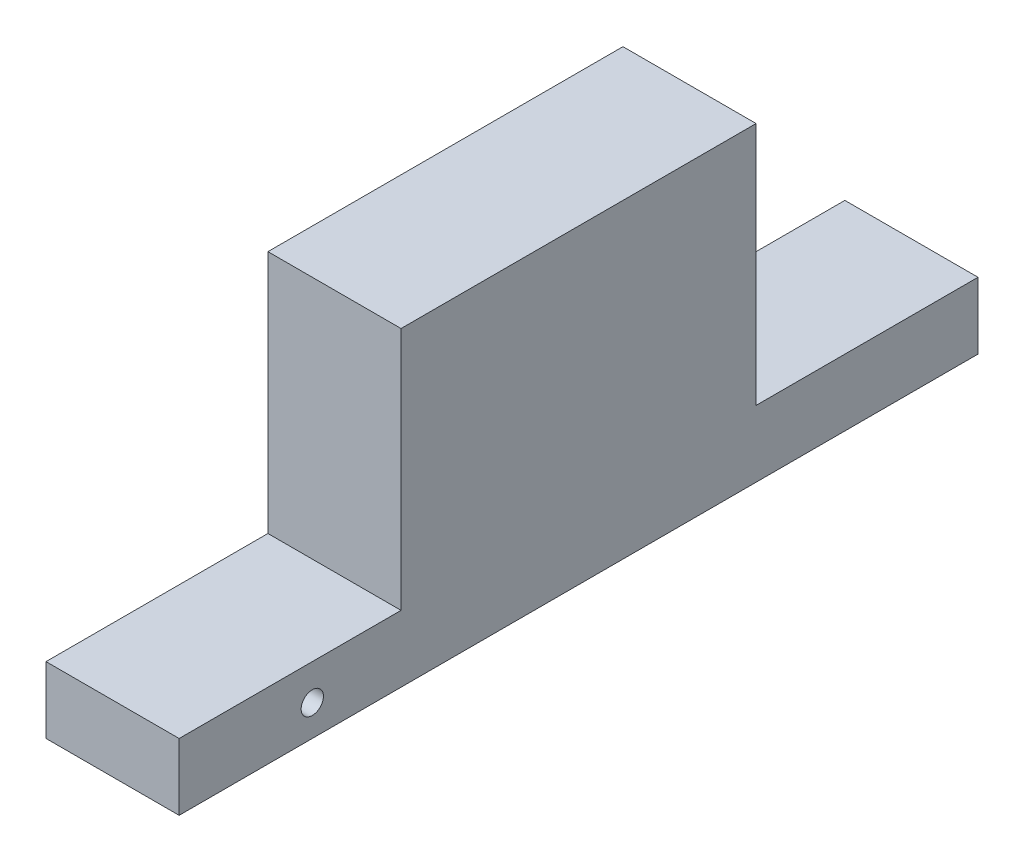
from build123d import *

# Parameters (mm, degrees)
MAINBODY_EXTRUDE_START        = -15
MAINBODY_EXTRUDE_DEPTH        = 30
PIVOTSHAFTHOLE_CUT_DEPTH      = 98.724101428
PIVOTSHAFTHOLE_CUT_DEPTH_BACK = 98.724101428
PIVOTSHAFTHOLE_SKETCH_R       = 2.51


with BuildPart() as part:
    # projectionYz_sketch → mainBody_extrude (new body)
    with BuildSketch(Plane(origin=(0, 0, 0), x_dir=(0, 0, -1), z_dir=(1, 0, 0)).offset(MAINBODY_EXTRUDE_START)):
        Polygon((90, -35), (90, -20), (40, -20), (40, 35), (-40, 35), (-40, -20), (-90, -20), (-90, -35), align=None)
    extrude(amount=MAINBODY_EXTRUDE_DEPTH)

    # pivotShaftHole_sketch → pivotShaftHole_cut (cut, two sides: drawn at the far end of the back side and taken through both)
    with BuildSketch(Plane(origin=(0, 0, 0), x_dir=(0, 0, -1), z_dir=(1, 0, 0)).offset(-PIVOTSHAFTHOLE_CUT_DEPTH_BACK)):
        with Locations((-60, -28)):
            Circle(PIVOTSHAFTHOLE_SKETCH_R)
    extrude(amount=PIVOTSHAFTHOLE_CUT_DEPTH + PIVOTSHAFTHOLE_CUT_DEPTH_BACK, mode=Mode.SUBTRACT)


solid = part.part
